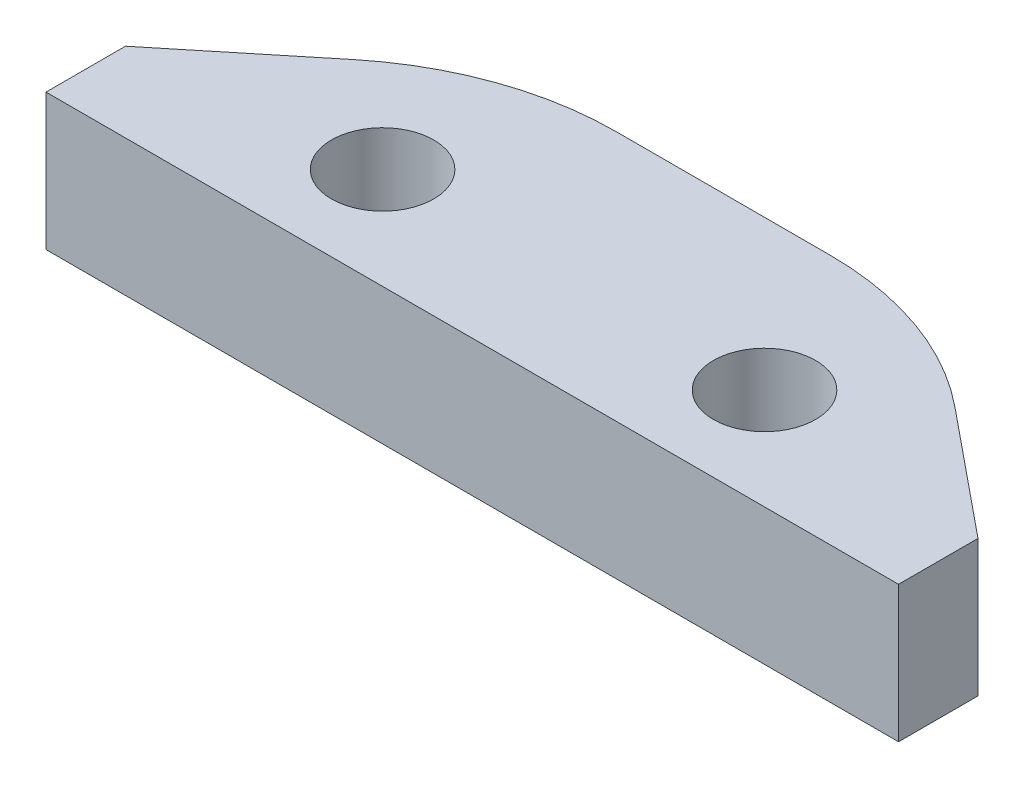
from build123d import *

# Parameters (mm, degrees)
SALIENTE_EXTRUIR1_DEPTH = 4
REDONDEO1_R             = 9
CROQUIS2_R              = 1.5
CORTAR_EXTRUIR1_DEPTH   = 15.510883067


with BuildPart() as part:
    # Croquis1 → Saliente-Extruir1 (new body)
    with BuildSketch(Plane(origin=(0, 0, 0), x_dir=(1, 0, 0), z_dir=(0, 1, 0))):
        Polygon((-6.340973223, 6.189969903), (6.340973223, 6.189969903), (12.5, 1.165), (12.5, -1.165), (-12.5, -1.165), (-12.5, 1.165), align=None)
    extrude(amount=SALIENTE_EXTRUIR1_DEPTH)

    # Redondeo1
    redondeo1_edges = [part.edges().sort_by_distance(p)[0] for p in [
        (-6.340973223, 2, -6.189969903),
        (6.340973223, 2, -6.189969903),
    ]]
    fillet(redondeo1_edges, radius=REDONDEO1_R)

    # Croquis2 → Cortar-Extruir1 (cut, through all)
    with BuildSketch(Plane(origin=(0, 4, 0), x_dir=(1, 0, 0), z_dir=(0, 1, 0))):
        with Locations(Location((-5.6, 1.805, 0), (0, 0, 270))):
            Circle(CROQUIS2_R)
        with Locations(Location((5.6, 1.805, 0), (0, 0, 270))):
            Circle(CROQUIS2_R)
    extrude(amount=-CORTAR_EXTRUIR1_DEPTH, mode=Mode.SUBTRACT)


solid = part.part
